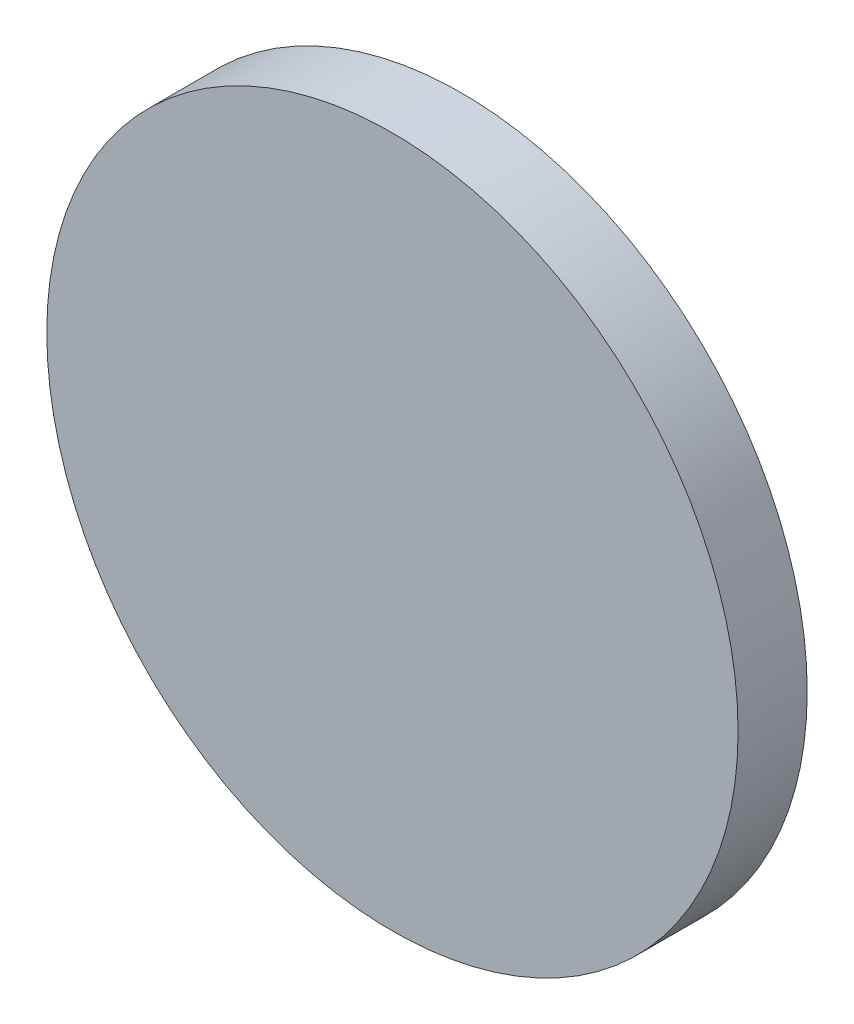
from build123d import *

# Parameters (mm, degrees)
SKETCH1_R           = 50
BOSS_EXTRUDE1_DEPTH = 10


with BuildPart() as part:
    # Sketch1 → Boss-Extrude1 (new body)
    with BuildSketch(Plane.XY):
        Circle(SKETCH1_R)
    extrude(amount=BOSS_EXTRUDE1_DEPTH)


solid = part.part
